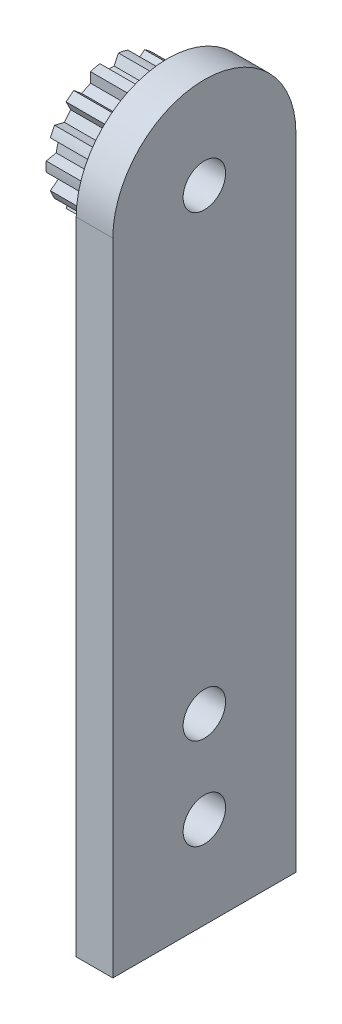
from build123d import *

# Parameters (mm, degrees)
SKETCH4_R             = 4.5339
SKETCH4_R_2           = 4.37515
CUT_EXTRUDE2_DEPTH    = 4.064
CUT_EXTRUDE1_DEPTH    = 4.064
CIRPATTERN1_COUNT     = 14
SKETCH6_R             = 1.5875
CUT_EXTRUDE3_DEPTH    = 12.02520933
CUT_EXTRUDE4_DEPTH    = 1.016
SKETCH11_R            = 6.731
CUT_EXTRUDE6_DEPTH    = 2.54
SKETCH13_R            = 9.525
CUT_EXTRUDE7_DEPTH    = 12.262802402
BOSS_EXTRUDE2_START   = -4.064
SKETCH17_R            = 1.5875
SKETCH17_R_2          = 1.4732
BOSS_EXTRUDE2_DEPTH   = 4.064
BOSS_EXTRUDE1_START   = 2.54
SKETCH12_R            = 1.4732
BOSS_EXTRUDE1_DEPTH   = 2.54
F_4_CLEARANCE_HOLE1_D = 2.9464


with BuildPart() as part:
    # Sketch1 → Revolve1 (revolve)
    with BuildSketch(Plane.XY, mode=Mode.PRIVATE) as revolve1_sk:
        with BuildLine():
            Line((-5.5626, 1.5875), (5.5626, 1.5875))
            Line((5.5626, 1.5875), (5.5626, 6.731))
            Line((5.5626, 6.731), (5.0419, 6.731))
            ThreePointArc((5.0419, 6.731), (4.654552953, 5.958878742), (4.5212, 5.1054))
            Line((4.5212, 5.1054), (4.5212, 4.5339))
            Line((4.5212, 4.5339), (0.4572, 4.5339))
            Line((0.4572, 4.5339), (0.4572, 5.6769))
            Line((0.4572, 5.6769), (-0.5969, 6.731))
            Line((-0.5969, 6.731), (-5.5626, 6.731))
            Line((-5.5626, 6.731), (-5.5626, 1.5875))
        make_face()
    revolve(revolve1_sk.sketch.rotate(Axis((-5.5626, 0, 0), (1, 0, 0)), 90), axis=Axis((-5.5626, 0, 0), (1, 0, 0)))

    # Sketch4 → Cut-Extrude2 (cut)
    with BuildSketch(Plane(origin=(0.4572, 0, 0), x_dir=(0, 0, -1), z_dir=(1, 0, 0))):
        Circle(SKETCH4_R)
        Circle(SKETCH4_R_2, mode=Mode.SUBTRACT)
    extrude(amount=CUT_EXTRUDE2_DEPTH, mode=Mode.SUBTRACT)

    # Sketch3 → Cut-Extrude1 (cut)
    with BuildSketch(Plane(origin=(0.4572, 0, 0), x_dir=(0, 0, -1), z_dir=(1, 0, 0))):
        with BuildLine():
            Line((-0.641613493, 4.327848154), (-0.345249615, 3.692293767))
            Line((-0.345249615, 3.692293767), (0.345249615, 3.692293767))
            Line((0.345249615, 3.692293767), (0.641613493, 4.327848154))
            ThreePointArc((0.641613493, 4.327848154), (0, 4.37515), (-0.641613493, 4.327848154))
        make_face()
    cut_extrude1 = extrude(amount=CUT_EXTRUDE1_DEPTH, mode=Mode.SUBTRACT)

    # CirPattern1: Cut-Extrude1 ×14 about axis
    cirpattern1_axis = Axis((0, 0, 0), (1, 0, 0))
    for i in range(1, CIRPATTERN1_COUNT):
        add(cut_extrude1.rotate(cirpattern1_axis, i * 360 / CIRPATTERN1_COUNT), mode=Mode.SUBTRACT)

    # Sketch6 → Cut-Extrude3 (cut, through all)
    with BuildSketch(Plane(origin=(0, 0, 0), x_dir=(1, 0, 0), z_dir=(0, 1, 0))):
        with Locations(Location((-2.5527, 0, 0), (0, 0, 90))):
            Circle(SKETCH6_R)
    extrude(amount=CUT_EXTRUDE3_DEPTH, mode=Mode.SUBTRACT)

    # Sketch11 → Cut-Extrude6 (cut)
    with BuildSketch(Plane.ZY.offset(-4.5212)):
        Circle(SKETCH11_R)
    extrude(amount=-CUT_EXTRUDE6_DEPTH, mode=Mode.SUBTRACT)


with BuildPart() as body_2:
    # Sketch7 → Revolve2 (revolve)
    with BuildSketch(Plane.XY, mode=Mode.PRIVATE) as revolve2_sk:
        Polygon((-3.7211, 6.731), (-2.5527, 6.731), (-2.5527, 1.9685), (-3.7211, 1.9685), (-3.9751, 2.2225), (-3.9751, 6.477), align=None)
    revolve(revolve2_sk.sketch.rotate(Axis((-2.5527, 1.9685, 0), (0, 1, 0)), 270), axis=Axis((-2.5527, 1.9685, 0), (0, 1, 0)))

    # Sketch8 → Cut-Extrude4 (cut)
    with BuildSketch(Plane(origin=(0, 6.731, 0), x_dir=(1, 0, 0), z_dir=(0, 1, 0))):
        Polygon((-2.5527, 0.821223023), (-3.2639, 0.410611511), (-3.2639, -0.410611511), (-2.5527, -0.821223023), (-1.8415, -0.410611511), (-1.8415, 0.410611511), align=None)
    extrude(amount=-CUT_EXTRUDE4_DEPTH, mode=Mode.SUBTRACT)


with BuildPart() as cut_extrude7_tool:
    # Sketch13 → Cut-Extrude7 (new, through all)
    with BuildSketch(Plane(origin=(0.4572, 0, 0), x_dir=(0, 0, -1), z_dir=(1, 0, 0))):
        Circle(SKETCH13_R)
    extrude(amount=-CUT_EXTRUDE7_DEPTH)


with BuildPart() as part_1:
    add(part.part)

    # Cut-Extrude7: cut by cut_extrude7_tool
    add(cut_extrude7_tool.part, mode=Mode.SUBTRACT)

    # Sketch17 → Boss-Extrude2 (add)
    with BuildSketch(Plane.ZY.offset(-0.4572).offset(BOSS_EXTRUDE2_START)):
        Circle(SKETCH17_R)
        Circle(SKETCH17_R_2, mode=Mode.SUBTRACT)
    extrude(amount=BOSS_EXTRUDE2_DEPTH)

    # Sketch12 → Boss-Extrude1 (add)
    with BuildSketch(Plane(origin=(4.5212, 0, 0), x_dir=(0, 0, -1), z_dir=(1, 0, 0)).offset(BOSS_EXTRUDE1_START)):
        with BuildLine():
            Line((6.35, 0), (6.35, -44.45))
            Line((6.35, -44.45), (-6.35, -44.45))
            Line((-6.35, -44.45), (-6.35, 0))
            ThreePointArc((-6.35, 0), (0, 6.35), (6.35, 0))
        make_face()
        with Locations(Location((0, 0, 0), (0, 0, 180))):
            Circle(SKETCH12_R, mode=Mode.SUBTRACT)
    extrude(amount=-BOSS_EXTRUDE1_DEPTH)

    # #4 Clearance Hole1 (through all)
    with Locations(Plane(origin=(7.0612, 0, 0), x_dir=(0, 0, -1), z_dir=(1, 0, 0))):
        with Locations((0, -31.75), (0, -38.1)):
            Hole(F_4_CLEARANCE_HOLE1_D / 2)


with BuildPart() as body_2_1:
    add(body_2.part)

    # Cut-Extrude7: cut by cut_extrude7_tool
    add(cut_extrude7_tool.part, mode=Mode.SUBTRACT)


solid = part_1.part
